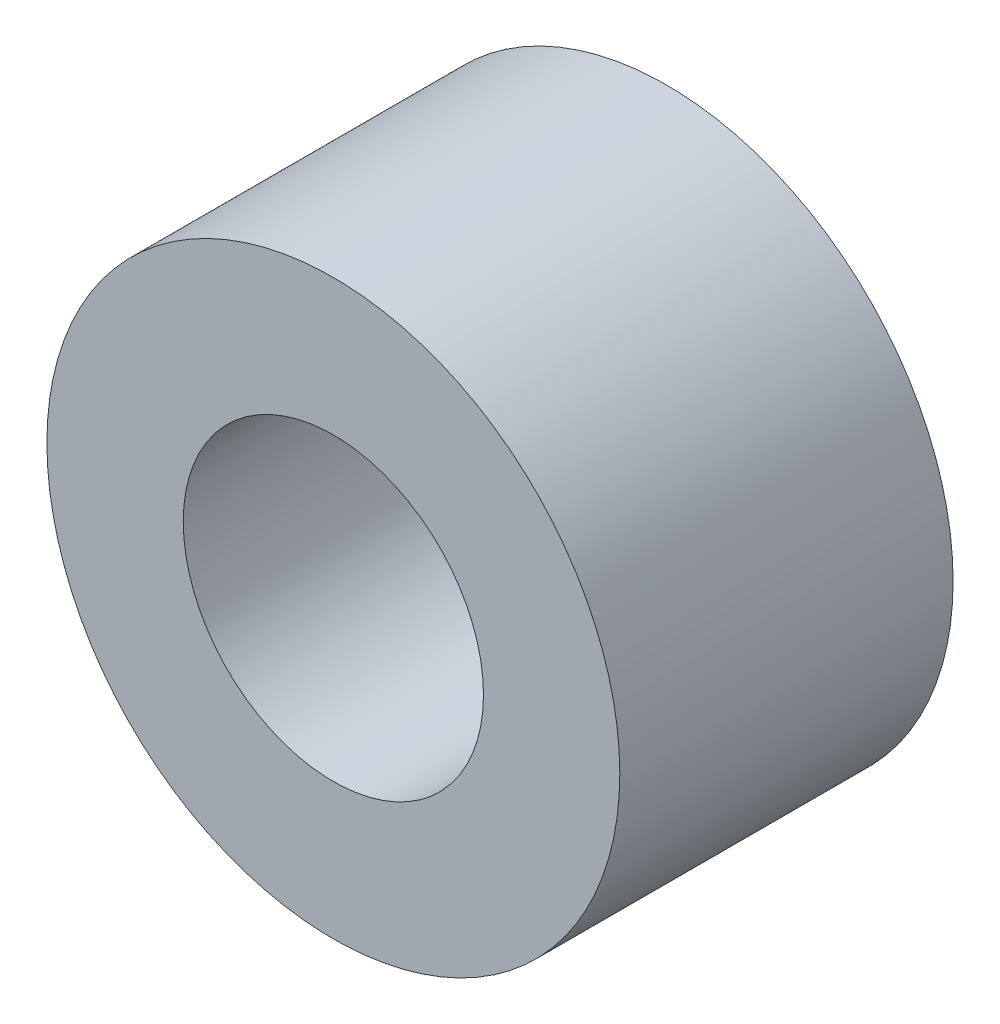
from build123d import *

# Parameters (mm, degrees)
ESQUISSE1_R        = 7.89
ESQUISSE1_R_2      = 4.135
BOSS_EXTRU_1_DEPTH = 9.18


with BuildPart() as part:
    # Esquisse1 → Boss.-Extru.1 (new body)
    with BuildSketch(Plane(origin=(0, 0, 0), x_dir=(0, 1, 0), z_dir=(0, 0, 1))):
        with Locations(Location((0, 0, 0), (0, 0, 270))):
            Circle(ESQUISSE1_R)
        with Locations(Location((0, 0, 0), (0, 0, 270))):
            Circle(ESQUISSE1_R_2, mode=Mode.SUBTRACT)
    extrude(amount=BOSS_EXTRU_1_DEPTH)


solid = part.part
